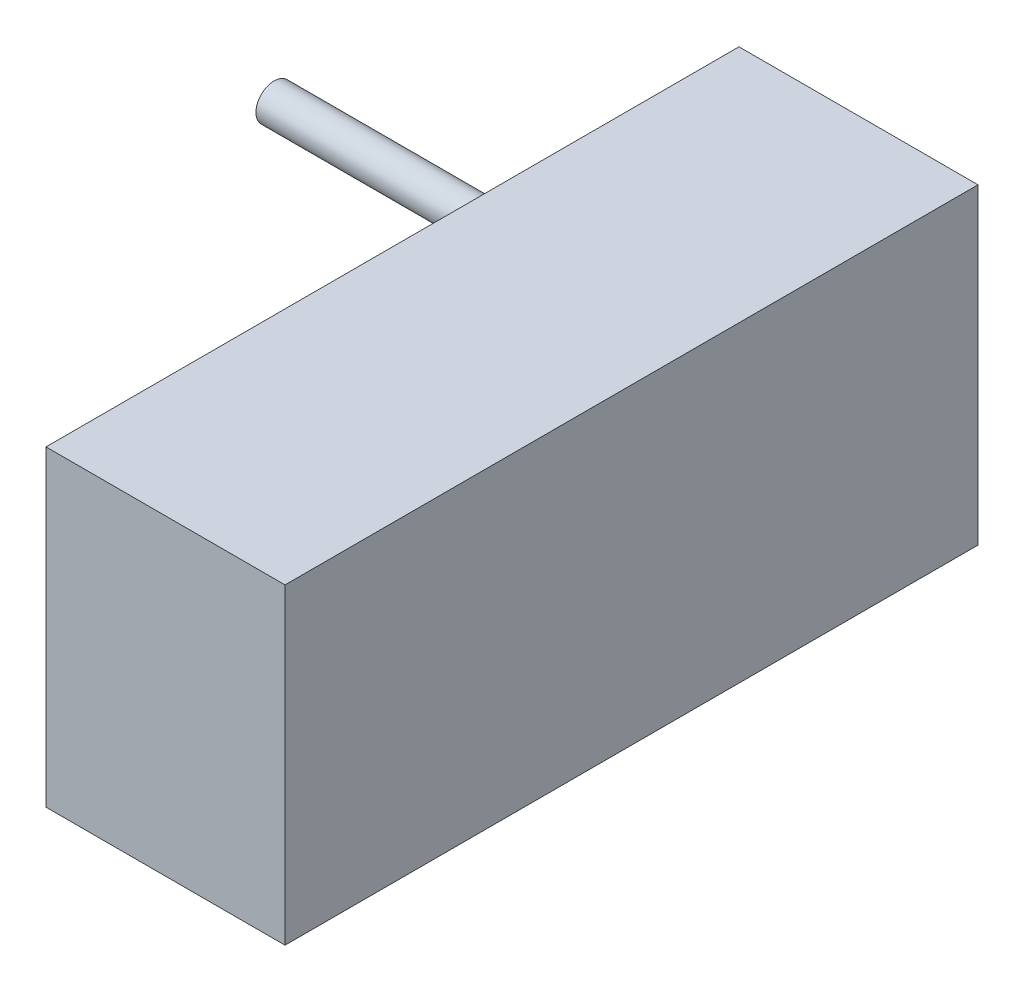
from build123d import *

# Parameters (mm, degrees)
ESQUISSE1_W        = 19.15
ESQUISSE1_H        = 55.52
BOSS_EXTRU_1_DEPTH = 25
ESQUISSE3_R        = 1.46
BOSS_EXTRU_2_DEPTH = 27.3


with BuildPart() as part:
    # Esquisse1 → Boss.-Extru.1 (new body)
    with BuildSketch(Plane(origin=(0, 0, 0), x_dir=(1, 0, 0), z_dir=(0, 1, 0))):
        with Locations((9.575, 27.76)):
            Rectangle(ESQUISSE1_W, ESQUISSE1_H)
    extrude(amount=BOSS_EXTRU_1_DEPTH)

    # Esquisse3 → Boss.-Extru.2 (add)
    with BuildSketch(Plane(origin=(0, 0, 0), x_dir=(0, 0, -1), z_dir=(1, 0, 0))):
        with Locations((45.58, 12.5)):
            Circle(ESQUISSE3_R)
    extrude(amount=-BOSS_EXTRU_2_DEPTH)


solid = part.part
